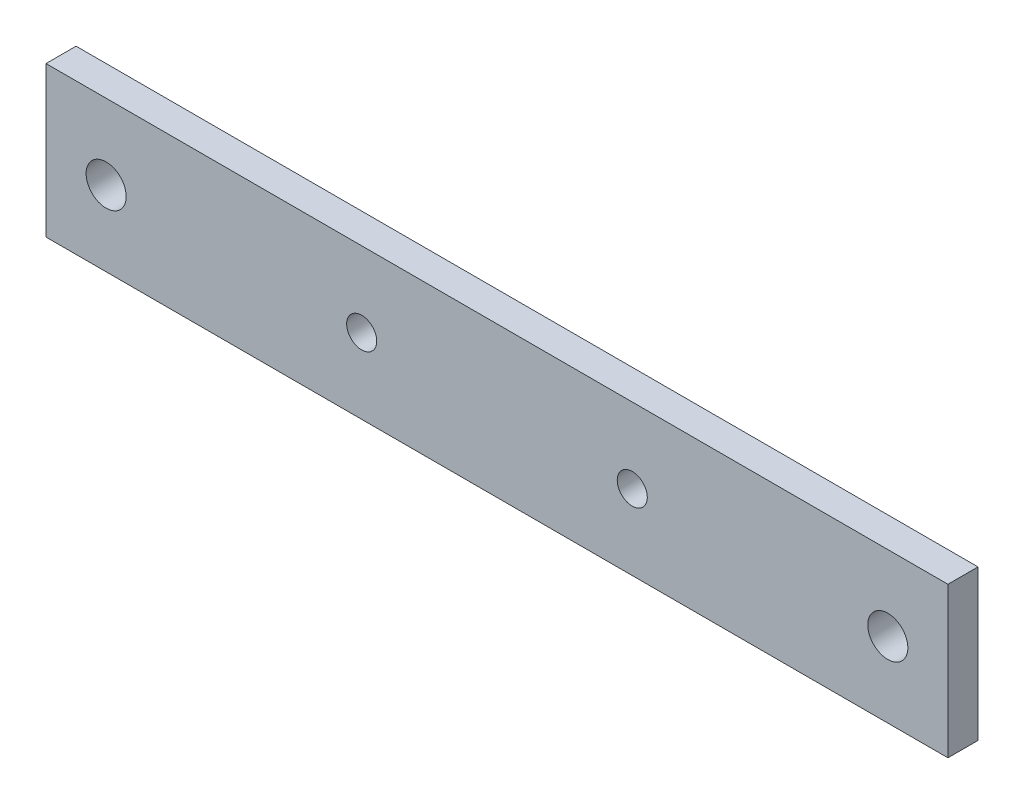
from build123d import *

# Parameters (mm, degrees)
SKETCH_1_W      = 90
SKETCH_1_H      = 15
SKETCH_1_R      = 1.5
SKETCH_1_R_2    = 2
EXTRUDE_1_DEPTH = 3


with BuildPart() as part:
    # 草图1 → 凸台-拉伸1 (new body)
    with BuildSketch(Plane.XY):
        Rectangle(SKETCH_1_W, SKETCH_1_H)
        with Locations((-13.5, 0)):
            Circle(SKETCH_1_R, mode=Mode.SUBTRACT)
        with Locations(Location((13.5, 0, 0), (0, 0, 180))):
            Circle(SKETCH_1_R, mode=Mode.SUBTRACT)
        with Locations((-39, 0)):
            Circle(SKETCH_1_R_2, mode=Mode.SUBTRACT)
        with Locations(Location((39, 0, 0), (0, 0, 180))):
            Circle(SKETCH_1_R_2, mode=Mode.SUBTRACT)
    extrude(amount=EXTRUDE_1_DEPTH)


solid = part.part
